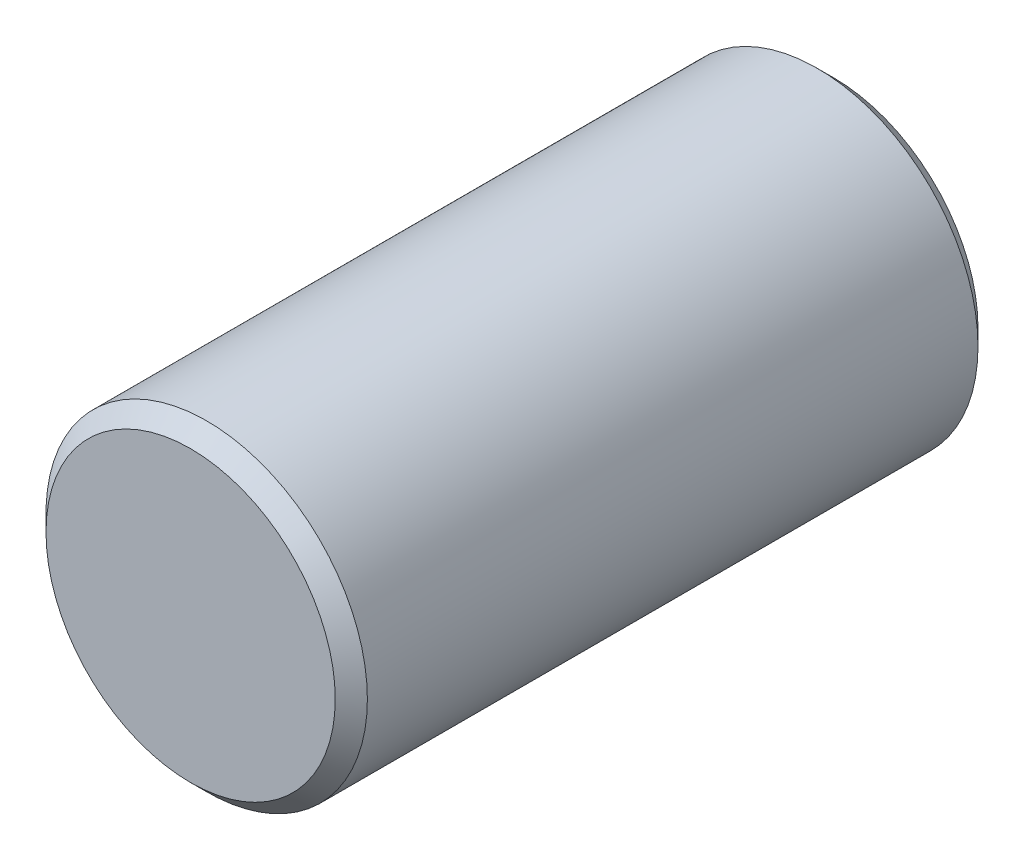
from build123d import *

# Parameters (mm, degrees)
SKETCH_1_R      = 2
EXTRUDE_1_DEPTH = 4
CHAMFER_1_SIZE  = 0.2


with BuildPart() as part:
    # 草图1 → 凸台-拉伸1 (new, symmetric)
    with BuildSketch(Plane.XY):
        Circle(SKETCH_1_R)
    extrude(amount=EXTRUDE_1_DEPTH, both=True)

    # 倒角1
    chamfer_1_edges = [part.edges().sort_by_distance(p)[0] for p in [
        (-2, 0, -4),
        (-2, 0, 4),
    ]]
    chamfer(chamfer_1_edges, length=CHAMFER_1_SIZE)


solid = part.part
